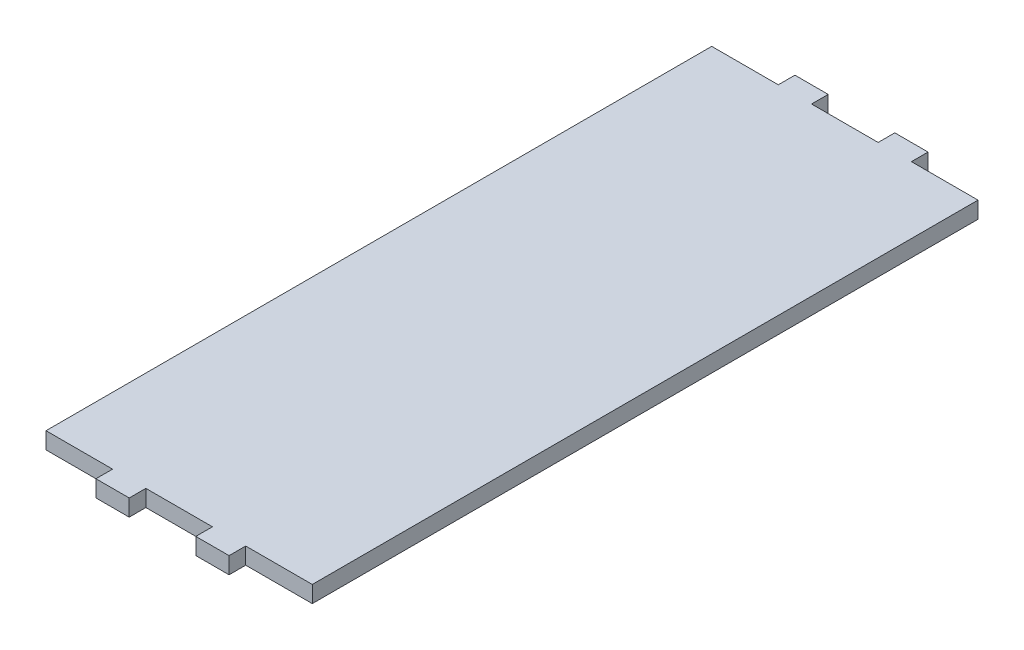
from build123d import *

# Parameters (mm, degrees)
SKETCH1_W           = 50.8
SKETCH1_H           = 127
SKETCH1_W_2         = 6.35
SKETCH1_H_2         = 3.175
BOSS_EXTRUDE1_DEPTH = 3.175


with BuildPart() as part:
    # Sketch1 → Boss-Extrude1 (new body)
    with BuildSketch(Plane(origin=(0, 0, 0), x_dir=(1, 0, 0), z_dir=(0, 1, 0))):
        Rectangle(SKETCH1_W, SKETCH1_H)
        with Locations((9.525, -65.0875)):
            Rectangle(SKETCH1_W_2, SKETCH1_H_2)
        with Locations((-9.525, -65.0875)):
            Rectangle(SKETCH1_W_2, SKETCH1_H_2)
        with Locations((-9.525, 65.0875)):
            Rectangle(SKETCH1_W_2, SKETCH1_H_2)
        with Locations((9.525, 65.0875)):
            Rectangle(SKETCH1_W_2, SKETCH1_H_2)
    extrude(amount=BOSS_EXTRUDE1_DEPTH)


solid = part.part
